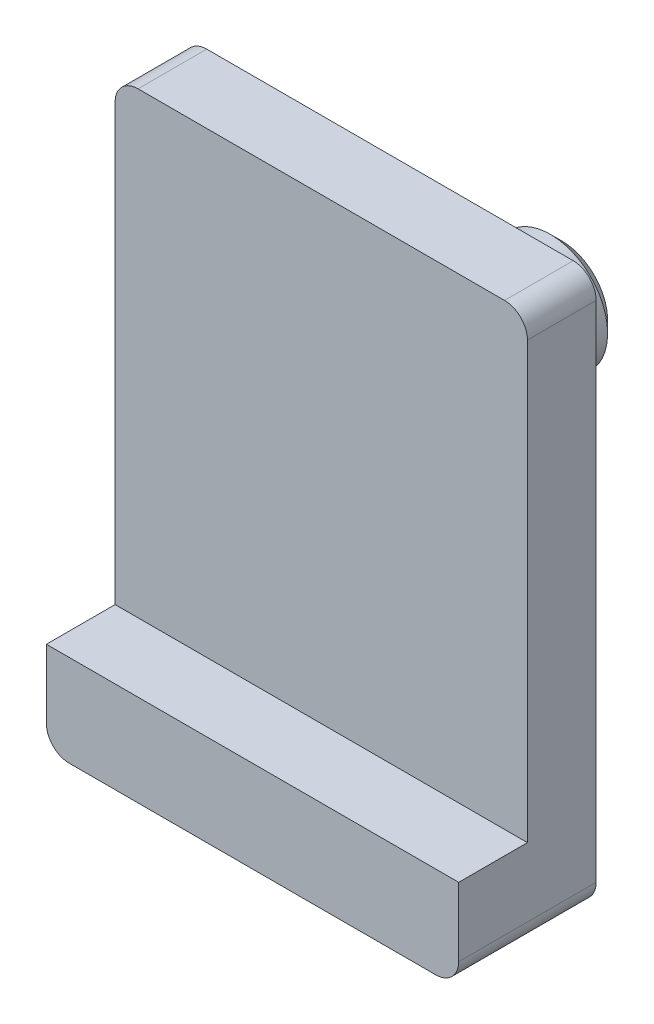
from build123d import *

# Parameters (mm, degrees)
BOSS_EXTRUDE1_DEPTH = 3
BOSS_EXTRUDE2_DEPTH = 3
SKETCH3_R           = 2.5
BOSS_EXTRUDE3_DEPTH = 1.5
CHAMFER1_SIZE       = 0.5


with BuildPart() as part:
    # Sketch1 → Boss-Extrude1 (new body)
    with BuildSketch(Plane.XY):
        with BuildLine():
            Line((1, 0), (17, 0))
            ThreePointArc((17, 0), (17.707106781, 0.292893219), (18, 1))
            Line((18, 1), (18, 23))
            ThreePointArc((18, 23), (17.707106781, 23.707106781), (17, 24))
            Line((17, 24), (1, 24))
            ThreePointArc((1, 24), (0.292893219, 23.707106781), (0, 23))
            Line((0, 23), (0, 1))
            ThreePointArc((0, 1), (0.292893219, 0.292893219), (1, 0))
        make_face()
    extrude(amount=BOSS_EXTRUDE1_DEPTH)

    # Sketch2 → Boss-Extrude2 (add)
    with BuildSketch(Plane.XY.offset(3)):
        with BuildLine():
            Line((1, 0), (17, 0))
            ThreePointArc((17, 0), (17.707106781, 0.292893219), (18, 1))
            Line((18, 1), (18, 4))
            Line((18, 4), (0, 4))
            Line((0, 4), (0, 1))
            ThreePointArc((0, 1), (0.292893219, 0.292893219), (1, 0))
        make_face()
    extrude(amount=BOSS_EXTRUDE2_DEPTH)

    # Sketch3 → Boss-Extrude3 (add)
    with BuildSketch(Plane(origin=(0, 0, 0), x_dir=(-1, 0, 0), z_dir=(0, 0, -1))):
        with Locations((-15, 21)):
            Circle(SKETCH3_R)
        with Locations((-3, 7)):
            Circle(SKETCH3_R)
    extrude(amount=BOSS_EXTRUDE3_DEPTH)

    # Chamfer1
    chamfer1_edges = [part.edges().sort_by_distance(p)[0] for p in [
        (17.5, 21, -1.5),
        (5.5, 7, -1.5),
    ]]
    chamfer(chamfer1_edges, length=CHAMFER1_SIZE)


solid = part.part
